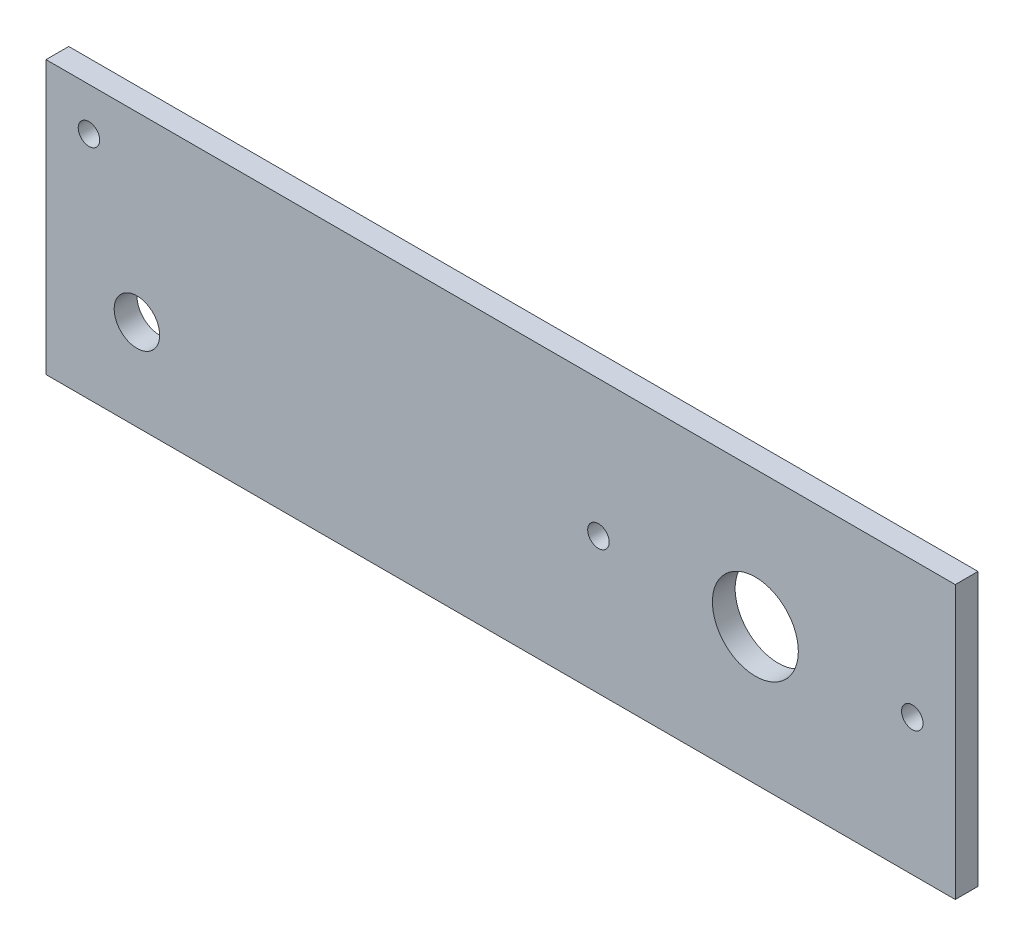
from build123d import *

# Parameters (mm, degrees)
SKETCH1_W           = 3.175
SKETCH1_H           = 38.1
BOSS_EXTRUDE1_DEPTH = 127
SKETCH2_R           = 3.175
SKETCH2_R_2         = 1.5
SKETCH2_R_3         = 6
CUT_EXTRUDE1_DEPTH  = 133.629900946


with BuildPart() as part:
    # Sketch1 → Boss-Extrude1 (new body)
    with BuildSketch(Plane(origin=(0, 0, 0), x_dir=(0, 0, -1), z_dir=(1, 0, 0))):
        with Locations((1.5875, 19.05)):
            Rectangle(SKETCH1_W, SKETCH1_H)
    extrude(amount=BOSS_EXTRUDE1_DEPTH)

    # Sketch2 → Cut-Extrude1 (cut, through all)
    with BuildSketch(Plane.XY):
        with Locations((12.7, 12.7)):
            Circle(SKETCH2_R)
        with Locations((121, 19.05)):
            Circle(SKETCH2_R_2)
        with Locations((99.079689783, 19.05)):
            Circle(SKETCH2_R_3)
        with Locations((77.159379566, 19.05)):
            Circle(SKETCH2_R_2)
        with Locations((6, 32.1)):
            Circle(SKETCH2_R_2)
    extrude(amount=-CUT_EXTRUDE1_DEPTH, mode=Mode.SUBTRACT)


solid = part.part
